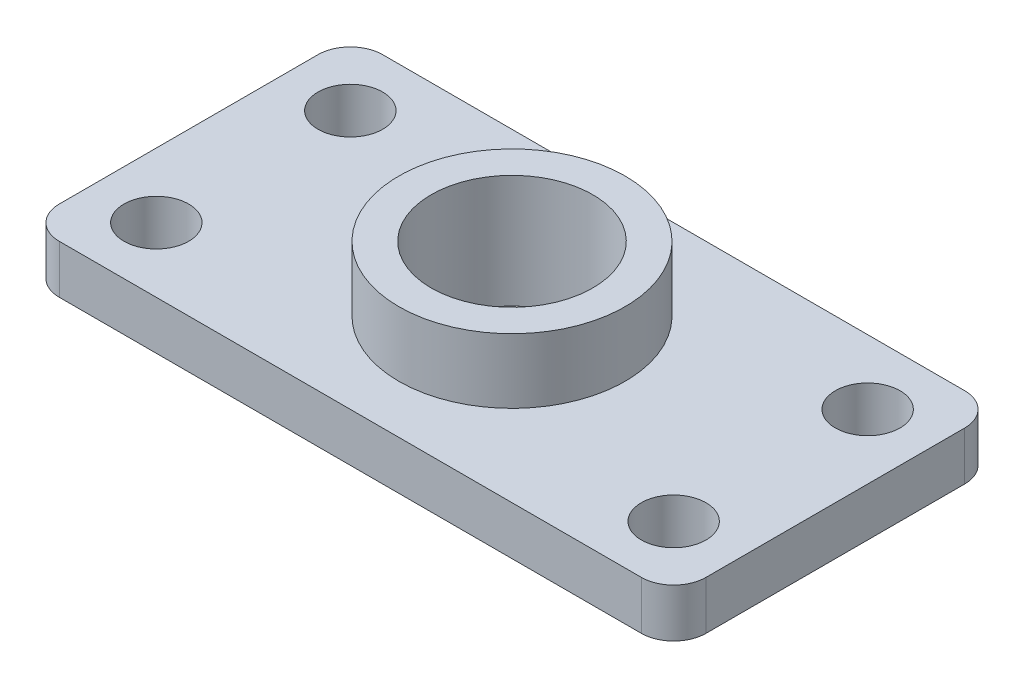
from build123d import *

# Parameters (mm, degrees)
SKETCH_1_W          = 200
SKETCH_1_H          = 100
EXTRUDE_1_DEPTH     = 15
SKETCH_2_R          = 35
EXTRUDE_2_DEPTH     = 20
SKETCH_3_R          = 25
CUT_EXTRUDE_1_DEPTH = 227.329405955
SKETCH_4_R          = 10
CUT_EXTRUDE_2_DEPTH = 225.499443206
FILLET_1_R          = 10


with BuildPart() as part:
    # Эскиз1 → Бобышка-Вытянуть1 (new body)
    with BuildSketch(Plane(origin=(0, 0, 0), x_dir=(1, 0, 0), z_dir=(0, 1, 0))):
        with Locations((100, 50)):
            Rectangle(SKETCH_1_W, SKETCH_1_H)
    extrude(amount=EXTRUDE_1_DEPTH)

    # Эскиз2 → Бобышка-Вытянуть2 (add)
    with BuildSketch(Plane(origin=(0, 15, 0), x_dir=(1, 0, 0), z_dir=(0, 1, 0))):
        with Locations(Location((100, 50, 0), (0, 0, 270))):
            Circle(SKETCH_2_R)
    extrude(amount=EXTRUDE_2_DEPTH)

    # Эскиз3 → Вырез-Вытянуть1 (cut, through all)
    with BuildSketch(Plane(origin=(0, 35, 0), x_dir=(1, 0, 0), z_dir=(0, 1, 0))):
        with Locations(Location((100, 50, 0), (0, 0, 270))):
            Circle(SKETCH_3_R)
    extrude(amount=-CUT_EXTRUDE_1_DEPTH, mode=Mode.SUBTRACT)

    # Эскиз4 → Вырез-Вытянуть2 (cut, through all)
    with BuildSketch(Plane(origin=(0, 15, 0), x_dir=(1, 0, 0), z_dir=(0, 1, 0))):
        with Locations(Location((20, 20, 0), (0, 0, 270))):
            Circle(SKETCH_4_R)
        with Locations(Location((20, 80, 0), (0, 0, 270))):
            Circle(SKETCH_4_R)
        with Locations(Location((180, 80, 0), (0, 0, 270))):
            Circle(SKETCH_4_R)
        with Locations(Location((180, 20, 0), (0, 0, 270))):
            Circle(SKETCH_4_R)
    extrude(amount=-CUT_EXTRUDE_2_DEPTH, mode=Mode.SUBTRACT)

    # Скругление1
    fillet_1_edges = [part.edges().sort_by_distance(p)[0] for p in [
        (0, 7.5, 0),
        (0, 7.5, -100),
        (200, 7.5, -100),
        (200, 7.5, 0),
    ]]
    fillet(fillet_1_edges, radius=FILLET_1_R)


solid = part.part
